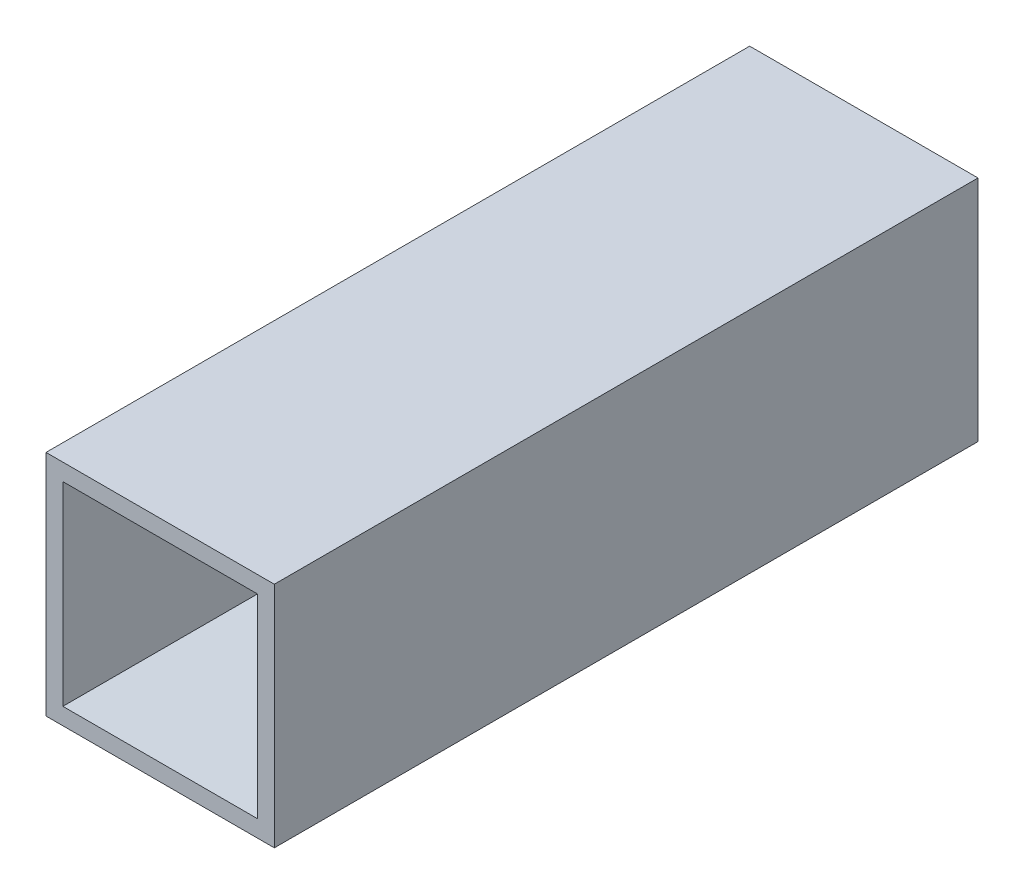
from build123d import *

# Parameters (mm, degrees)
SKETCH1_W           = 305
SKETCH1_H           = 305
BOSS_EXTRUDE2_DEPTH = 874
SKETCH3_W           = 100
SKETCH3_H           = 100
BOSS_EXTRUDE4_DEPTH = 100
CUT_EXTRUDE3_DEPTH  = 100
SKETCH8_W           = 305
SKETCH8_H           = 305
BOSS_EXTRUDE5_DEPTH = 66


with BuildPart() as part:
    # Sketch1 → Boss-Extrude2 (new body)
    with BuildSketch(Plane.XY):
        with Locations((152.5, 152.5)):
            Rectangle(SKETCH1_W, SKETCH1_H)
    extrude(amount=BOSS_EXTRUDE2_DEPTH)

    # Sketch3 → Boss-Extrude4 (add)
    with BuildSketch(Plane.ZY):
        with Locations((774, 152.5)):
            Rectangle(SKETCH3_W, SKETCH3_H)
    extrude(amount=BOSS_EXTRUDE4_DEPTH)

    # Sketch5 → Cut-Extrude3 (cut)
    with BuildSketch(Plane.XZ.offset(-102.5)):
        Polygon((-100, 824), (0, 824), (-100, 724), align=None)
    extrude(amount=-CUT_EXTRUDE3_DEPTH, mode=Mode.SUBTRACT)

    # Sketch2 → Cut-Loft2 section 0
    with BuildSketch(Plane(origin=(0, 0, 0), x_dir=(-1, 0, 0), z_dir=(0, 0, -1))):
        with BuildLine():
            Line((-242.5, 242.5), (-62.5, 242.5))
            Line((-62.5, 242.5), (-62.5, 62.5))
            Line((-62.5, 62.5), (-242.5, 62.5))
            Line((-242.5, 62.5), (-242.5, 242.5))
        make_face()
    # Sketch6 → Cut-Loft2 section 1
    with BuildSketch(Plane.XY.offset(874)):
        with BuildLine():
            Line((22.5, 282.5), (282.5, 282.5))
            Line((282.5, 282.5), (282.5, 22.5))
            Line((282.5, 22.5), (22.5, 22.5))
            Line((22.5, 22.5), (22.5, 282.5))
        make_face()
    loft(mode=Mode.SUBTRACT)

    # Sketch8 → Boss-Extrude5 (add)
    with BuildSketch(Plane(origin=(0, 0, 0), x_dir=(-1, 0, 0), z_dir=(0, 0, -1))):
        with Locations((-152.5, 152.5)):
            Rectangle(SKETCH8_W, SKETCH8_H)
    extrude(amount=BOSS_EXTRUDE5_DEPTH)


solid = part.part
